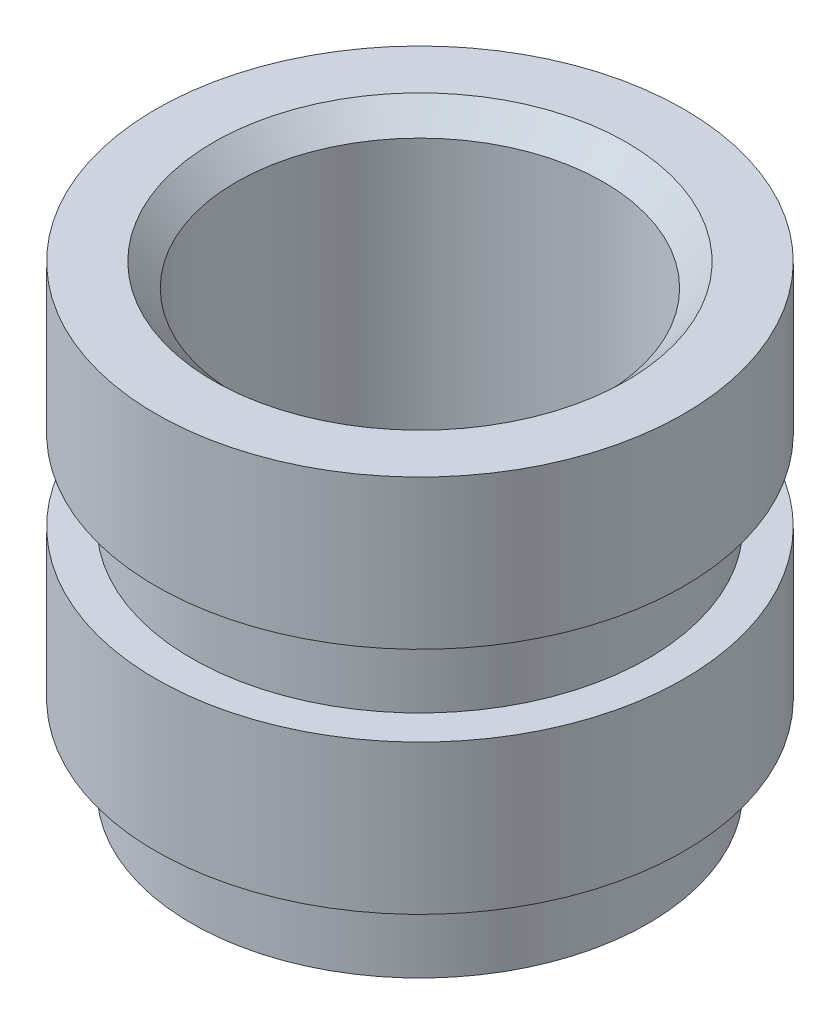
from build123d import *

# Parameters (mm, degrees)
CHAMFER_1_SIZE = 0.1


with BuildPart() as part:
    # 草图1 → 旋转1 (revolve)
    with BuildSketch(Plane.XY, mode=Mode.PRIVATE) as revolve_1_sk:
        Polygon((-0.8, 1.2084448), (-1.15, 1.2084448), (-1.15, 0.5584448), (-0.994666244, 0.5584448), (-0.994666244, 0.2084448), (-1.15, 0.2084448), (-1.15, -0.4415552), (-0.994666244, -0.4415552), (-0.994666244, -0.7915552), (-0.8, -0.7915552), align=None)
    revolve(revolve_1_sk.sketch.rotate(Axis((0, -2.604693141, 0), (0, 1, 0)), 270), axis=Axis((0, -2.604693141, 0), (0, 1, 0)))

    # 倒角1
    chamfer_1_edges = [part.edges().sort_by_distance(p)[0] for p in [
        (0, 1.2084448, 0.8),
        (0, -0.7915552, 0.8),
    ]]
    chamfer(chamfer_1_edges, length=CHAMFER_1_SIZE)


solid = part.part
